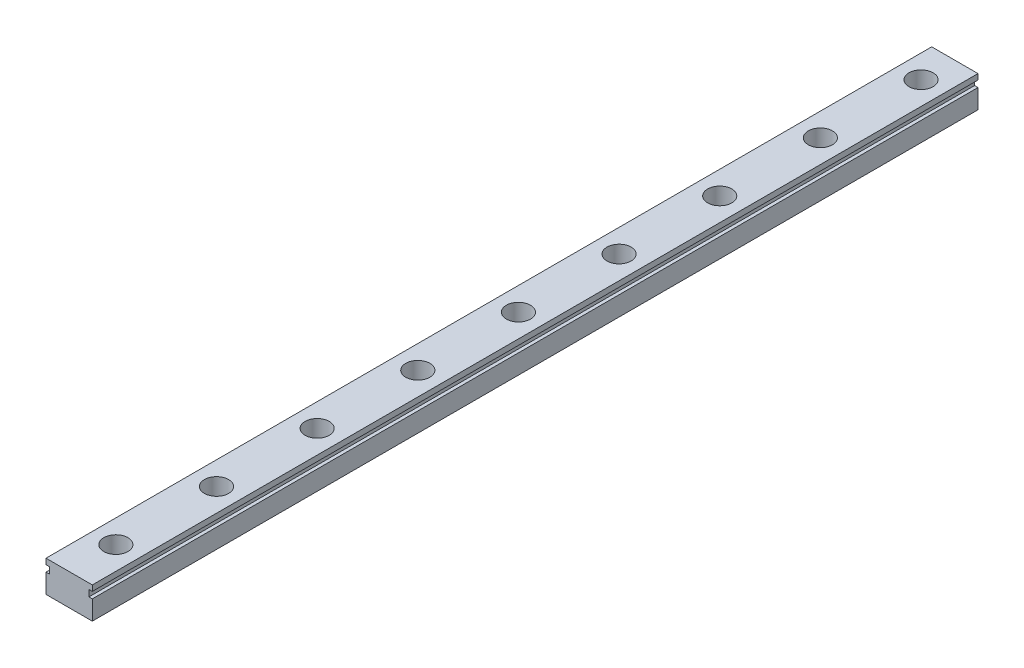
from build123d import *

# Parameters (mm, degrees)
SKETCH1_W           = 11.5
SKETCH1_H           = 7.8
BOSS_EXTRUDE1_DEPTH = 220
SKETCH2_W           = 0.835250229
SKETCH2_H           = 1.6
CUT_EXTRUDE1_DEPTH  = 221.109682886
SKETCH3_R           = 3
CUT_EXTRUDE2_DEPTH  = 4.7
SKETCH4_R           = 1.7
CUT_EXTRUDE3_DEPTH  = 221.125310903


with BuildPart() as part:
    # Sketch1 → Boss-Extrude1 (new body)
    with BuildSketch(Plane.XY):
        Rectangle(SKETCH1_W, SKETCH1_H)
    extrude(amount=BOSS_EXTRUDE1_DEPTH)

    # Sketch2 → Cut-Extrude1 (cut, through all)
    with BuildSketch(Plane.XY.offset(220)):
        with Locations((5.332374886, 1.7)):
            Rectangle(SKETCH2_W, SKETCH2_H)
        with Locations((-5.332374886, 1.7)):
            Rectangle(SKETCH2_W, SKETCH2_H)
    extrude(amount=-CUT_EXTRUDE1_DEPTH, mode=Mode.SUBTRACT)

    # Sketch3 → Cut-Extrude2 (cut)
    with BuildSketch(Plane(origin=(0, 3.9, 0), x_dir=(1, 0, 0), z_dir=(0, 1, 0))):
        with Locations(Location((0, -208.4, 0), (0, 0, 270))):
            Circle(SKETCH3_R)
        with Locations(Location((0, -183.4, 0), (0, 0, 270))):
            Circle(SKETCH3_R)
        with Locations(Location((0, -158.4, 0), (0, 0, 270))):
            Circle(SKETCH3_R)
        with Locations(Location((0, -133.4, 0), (0, 0, 270))):
            Circle(SKETCH3_R)
        with Locations(Location((0, -108.4, 0), (0, 0, 270))):
            Circle(SKETCH3_R)
        with Locations(Location((0, -83.4, 0), (0, 0, 270))):
            Circle(SKETCH3_R)
        with Locations(Location((0, -58.4, 0), (0, 0, 270))):
            Circle(SKETCH3_R)
        with Locations(Location((0, -33.4, 0), (0, 0, 270))):
            Circle(SKETCH3_R)
        with Locations(Location((0, -8.4, 0), (0, 0, 270))):
            Circle(SKETCH3_R)
        with Locations((0, 16.6)):
            Circle(SKETCH3_R)
        with Locations((0, 41.6)):
            Circle(SKETCH3_R)
        with Locations((0, 66.6)):
            Circle(SKETCH3_R)
        with Locations((0, 91.6)):
            Circle(SKETCH3_R)
        with Locations((0, 116.6)):
            Circle(SKETCH3_R)
        with Locations((0, 141.6)):
            Circle(SKETCH3_R)
        with Locations((0, 166.6)):
            Circle(SKETCH3_R)
        with Locations((0, 191.6)):
            Circle(SKETCH3_R)
        with Locations((0, 216.6)):
            Circle(SKETCH3_R)
        with Locations((0, 241.6)):
            Circle(SKETCH3_R)
        with Locations((0, 266.6)):
            Circle(SKETCH3_R)
        with Locations((0, 291.6)):
            Circle(SKETCH3_R)
        with Locations((0, 316.6)):
            Circle(SKETCH3_R)
        with Locations((0, 341.6)):
            Circle(SKETCH3_R)
        with Locations((0, 366.6)):
            Circle(SKETCH3_R)
        with Locations((0, 391.6)):
            Circle(SKETCH3_R)
        with Locations((0, 416.6)):
            Circle(SKETCH3_R)
        with Locations((0, 441.6)):
            Circle(SKETCH3_R)
        with Locations((0, 466.6)):
            Circle(SKETCH3_R)
        with Locations((0, 491.6)):
            Circle(SKETCH3_R)
        with Locations((0, 516.6)):
            Circle(SKETCH3_R)
    extrude(amount=-CUT_EXTRUDE2_DEPTH, mode=Mode.SUBTRACT)

    # Sketch4 → Cut-Extrude3 (cut, through all)
    with BuildSketch(Plane(origin=(0, -0.8, 0), x_dir=(1, 0, 0), z_dir=(0, 1, 0))):
        with Locations(Location((0, -208.4, 0), (0, 0, 270))):
            Circle(SKETCH4_R)
        with Locations(Location((0, -183.4, 0), (0, 0, 270))):
            Circle(SKETCH4_R)
        with Locations(Location((0, -158.4, 0), (0, 0, 270))):
            Circle(SKETCH4_R)
        with Locations(Location((0, -133.4, 0), (0, 0, 270))):
            Circle(SKETCH4_R)
        with Locations(Location((0, -108.4, 0), (0, 0, 270))):
            Circle(SKETCH4_R)
        with Locations(Location((0, -83.4, 0), (0, 0, 270))):
            Circle(SKETCH4_R)
        with Locations(Location((0, -58.4, 0), (0, 0, 270))):
            Circle(SKETCH4_R)
        with Locations(Location((0, -33.4, 0), (0, 0, 270))):
            Circle(SKETCH4_R)
        with Locations(Location((0, -8.4, 0), (0, 0, 270))):
            Circle(SKETCH4_R)
        with Locations((0, 16.6)):
            Circle(SKETCH4_R)
        with Locations((0, 41.6)):
            Circle(SKETCH4_R)
        with Locations((0, 66.6)):
            Circle(SKETCH4_R)
        with Locations((0, 91.6)):
            Circle(SKETCH4_R)
        with Locations((0, 116.6)):
            Circle(SKETCH4_R)
        with Locations((0, 141.6)):
            Circle(SKETCH4_R)
        with Locations((0, 166.6)):
            Circle(SKETCH4_R)
        with Locations((0, 191.6)):
            Circle(SKETCH4_R)
        with Locations((0, 216.6)):
            Circle(SKETCH4_R)
        with Locations((0, 241.6)):
            Circle(SKETCH4_R)
        with Locations((0, 266.6)):
            Circle(SKETCH4_R)
        with Locations((0, 291.6)):
            Circle(SKETCH4_R)
        with Locations((0, 316.6)):
            Circle(SKETCH4_R)
        with Locations((0, 341.6)):
            Circle(SKETCH4_R)
        with Locations((0, 366.6)):
            Circle(SKETCH4_R)
        with Locations((0, 391.6)):
            Circle(SKETCH4_R)
        with Locations((0, 416.6)):
            Circle(SKETCH4_R)
        with Locations((0, 441.6)):
            Circle(SKETCH4_R)
        with Locations((0, 466.6)):
            Circle(SKETCH4_R)
        with Locations((0, 491.6)):
            Circle(SKETCH4_R)
        with Locations((0, 516.6)):
            Circle(SKETCH4_R)
    extrude(amount=-CUT_EXTRUDE3_DEPTH, mode=Mode.SUBTRACT)


solid = part.part
